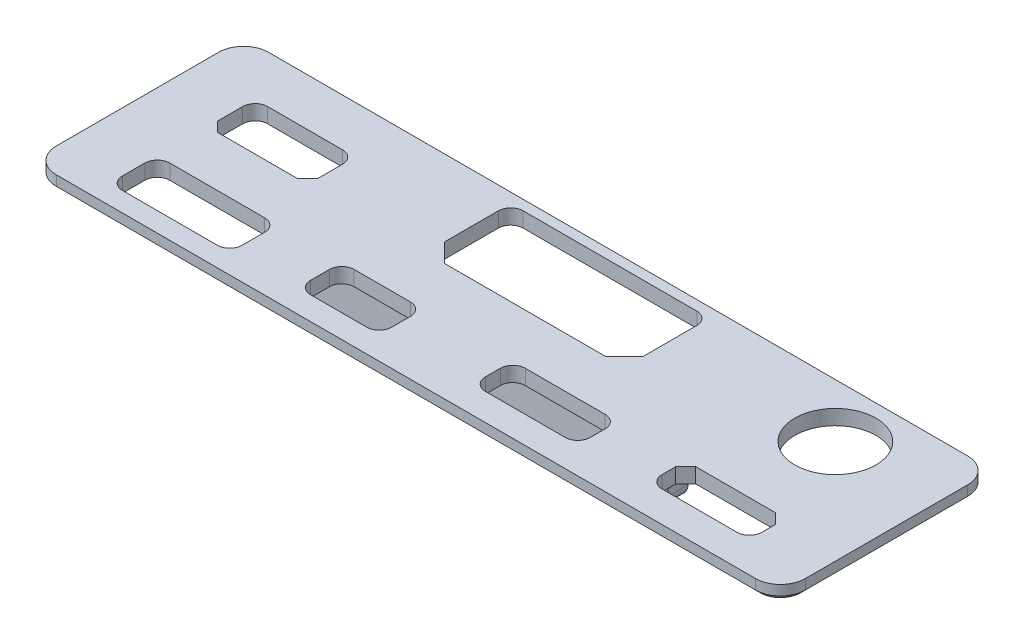
from build123d import *

# Parameters (mm, degrees)
SKETCH_1_W          = 60
SKETCH_1_H          = 17
EXTRUDE_1_DEPTH     = 1.2
CUT_EXTRUDE_1_REACH = 33.204
SKETCH_4_R          = 3.25
SKETCH_4_W          = 8
SKETCH_4_H          = 3.8
SKETCH_4_W_2        = 15.9
SKETCH_4_H_2        = 6.8
SKETCH_4_H_3        = 2.9
SKETCH_4_W_3        = 8.4
SKETCH_4_H_4        = 3.2
SKETCH_4_W_4        = 6.5
SKETCH_4_H_5        = 3.5
SKETCH_4_W_5        = 9.6
FILLET_2_R          = 1
CHAMFER_1_SIZE      = 0.8
SKETCH_5_W          = 1.5
SKETCH_5_H          = 8
EXTRUDE_2_DEPTH     = 1.2
SKETCH_6_W          = 28.5
SKETCH_6_H          = 1.6
EXTRUDE_3_DEPTH     = 4
FILLET_3_R          = 1
CHAMFER_2_SIZE      = 1
FILLET_4_R          = 2
CHAMFER_5_SIZE      = 0.4
CHAMFER_6_SIZE      = 1.5


with BuildPart() as part:
    # 草图1 → 凸台-拉伸1 (new body)
    with BuildSketch(Plane(origin=(0, 0, 0), x_dir=(1, 0, 0), z_dir=(0, 1, 0))):
        Rectangle(SKETCH_1_W, SKETCH_1_H)
    extrude(amount=EXTRUDE_1_DEPTH)

    # 草图4 → 切除-拉伸1 (cut, up to next)
    with BuildSketch(Plane(origin=(0, 1.2, 0), x_dir=(1, 0, 0), z_dir=(0, 1, 0)), mode=Mode.PRIVATE) as cut_extrude_1_sk1:
        with Locations(Location((21.7, 4.2, 0), (0, 0, 270))):
            Circle(SKETCH_4_R)
    cut_extrude_1_tool1 = extrude(cut_extrude_1_sk1.sketch, amount=-CUT_EXTRUDE_1_REACH, mode=Mode.PRIVATE) & part.part
    # 草图4 → 切除-拉伸1 (cut, up to next)
    with BuildSketch(Plane(origin=(0, 1.2, 0), x_dir=(1, 0, 0), z_dir=(0, 1, 0)), mode=Mode.PRIVATE) as cut_extrude_1_sk2:
        with Locations((-21.271722325, 2.8)):
            Rectangle(SKETCH_4_W, SKETCH_4_H)
    cut_extrude_1_tool2 = extrude(cut_extrude_1_sk2.sketch, amount=-CUT_EXTRUDE_1_REACH, mode=Mode.PRIVATE) & part.part
    # 草图4 → 切除-拉伸1 (cut, up to next)
    with BuildSketch(Plane(origin=(0, 1.2, 0), x_dir=(1, 0, 0), z_dir=(0, 1, 0)), mode=Mode.PRIVATE) as cut_extrude_1_sk3:
        with Locations((0.15, 4.3)):
            Rectangle(SKETCH_4_W_2, SKETCH_4_H_2)
    cut_extrude_1_tool3 = extrude(cut_extrude_1_sk3.sketch, amount=-CUT_EXTRUDE_1_REACH, mode=Mode.PRIVATE) & part.part
    # 草图4 → 切除-拉伸1 (cut, up to next)
    with BuildSketch(Plane(origin=(0, 1.2, 0), x_dir=(1, 0, 0), z_dir=(0, 1, 0)), mode=Mode.PRIVATE) as cut_extrude_1_sk4:
        with Locations((21.05, -4.584803861)):
            Rectangle(SKETCH_4_W, SKETCH_4_H_3)
    cut_extrude_1_tool4 = extrude(cut_extrude_1_sk4.sketch, amount=-CUT_EXTRUDE_1_REACH, mode=Mode.PRIVATE) & part.part
    # 草图4 → 切除-拉伸1 (cut, up to next)
    with BuildSketch(Plane(origin=(0, 1.2, 0), x_dir=(1, 0, 0), z_dir=(0, 1, 0)), mode=Mode.PRIVATE) as cut_extrude_1_sk5:
        with Locations((7.4, -4.734803861)):
            Rectangle(SKETCH_4_W_3, SKETCH_4_H_4)
    cut_extrude_1_tool5 = extrude(cut_extrude_1_sk5.sketch, amount=-CUT_EXTRUDE_1_REACH, mode=Mode.PRIVATE) & part.part
    # 草图4 → 切除-拉伸1 (cut, up to next)
    with BuildSketch(Plane(origin=(0, 1.2, 0), x_dir=(1, 0, 0), z_dir=(0, 1, 0)), mode=Mode.PRIVATE) as cut_extrude_1_sk6:
        with Locations((-7.25, -4.884803861)):
            Rectangle(SKETCH_4_W_4, SKETCH_4_H_5)
    cut_extrude_1_tool6 = extrude(cut_extrude_1_sk6.sketch, amount=-CUT_EXTRUDE_1_REACH, mode=Mode.PRIVATE) & part.part
    # 草图4 → 切除-拉伸1 (cut, up to next)
    with BuildSketch(Plane(origin=(0, 1.2, 0), x_dir=(1, 0, 0), z_dir=(0, 1, 0)), mode=Mode.PRIVATE) as cut_extrude_1_sk7:
        with Locations((-20.471722325, -5.034803861)):
            Rectangle(SKETCH_4_W_5, SKETCH_4_H)
    cut_extrude_1_tool7 = extrude(cut_extrude_1_sk7.sketch, amount=-CUT_EXTRUDE_1_REACH, mode=Mode.PRIVATE) & part.part
    add(cut_extrude_1_tool1.solids().sort_by_distance((21.7, 1.2, -4.2))[0], mode=Mode.SUBTRACT)
    add(cut_extrude_1_tool2.solids().sort_by_distance((-21.271722, 1.2, -2.8))[0], mode=Mode.SUBTRACT)
    add(cut_extrude_1_tool3.solids().sort_by_distance((0.15, 1.2, -4.3))[0], mode=Mode.SUBTRACT)
    add(cut_extrude_1_tool4.solids().sort_by_distance((21.05, 1.2, 4.584804))[0], mode=Mode.SUBTRACT)
    add(cut_extrude_1_tool5.solids().sort_by_distance((7.4, 1.2, 4.734804))[0], mode=Mode.SUBTRACT)
    add(cut_extrude_1_tool6.solids().sort_by_distance((-7.25, 1.2, 4.884804))[0], mode=Mode.SUBTRACT)
    add(cut_extrude_1_tool7.solids().sort_by_distance((-20.471722, 1.2, 5.034804))[0], mode=Mode.SUBTRACT)

    # 圆角2
    fillet_2_edges = [part.edges().sort_by_distance(p)[0] for p in [
        (-10.5, 0.6, 6.634803861),
        (-10.5, 0.6, 3.134803861),
        (-4, 0.6, 3.134803861),
        (-4, 0.6, 6.634803861),
        (3.2, 0.6, 6.334803861),
        (3.2, 0.6, 3.134803861),
        (11.6, 0.6, 3.134803861),
        (11.6, 0.6, 6.334803861),
        (17.05, 0.6, 6.034803861),
        (25.05, 0.6, 6.034803861),
        (-7.8, 0.6, -7.7),
        (8.1, 0.6, -7.7),
        (-25.271722325, 0.6, 6.934803861),
        (-25.271722325, 0.6, 3.134803861),
        (-15.671722325, 0.6, 3.134803861),
        (-15.671722325, 0.6, 6.934803861),
        (-25.271722325, 0.6, -4.7),
        (-17.271722325, 0.6, -4.7),
    ]]
    fillet(fillet_2_edges, radius=FILLET_2_R)

    # 倒角1
    chamfer_1_edges = [part.edges().sort_by_distance(p)[0] for p in [
        (17.05, 0.6, 3.134803861),
        (25.05, 0.6, 3.134803861),
        (-25.271722325, 0.6, -0.9),
        (-17.271722325, 0.6, -0.9),
    ]]
    chamfer(chamfer_1_edges, length=CHAMFER_1_SIZE)

    # 草图5 → 凸台-拉伸2 (add)
    with BuildSketch(Plane.XZ):
        with Locations((-13.15891381, 0.61681071)):
            Rectangle(SKETCH_5_W, SKETCH_5_H)
        with Locations((13.84108619, 0.61681071)):
            Rectangle(SKETCH_5_W, SKETCH_5_H)
    extrude(amount=EXTRUDE_2_DEPTH)

    # 草图6 → 凸台-拉伸3 (add)
    with BuildSketch(Plane.XZ):
        with Locations((0.34108619, 1.3)):
            Rectangle(SKETCH_6_W, SKETCH_6_H)
    extrude(amount=EXTRUDE_3_DEPTH)

    # 圆角3
    fillet_3_edges = [part.edges().sort_by_distance(p)[0] for p in [
        (-13.90891381, -4, 1.3),
        (14.59108619, -4, 1.3),
    ]]
    fillet(fillet_3_edges, radius=FILLET_3_R)

    # 倒角2
    chamfer_2_edges = [part.edges().sort_by_distance(p)[0] for p in [
        (-13.15891381, -1.2, -3.38318929),
        (-13.15891381, -1.2, 4.61681071),
        (13.84108619, -1.2, -3.38318929),
        (13.84108619, -1.2, 4.61681071),
    ]]
    chamfer(chamfer_2_edges, length=CHAMFER_2_SIZE)

    # 圆角4
    fillet_4_edges = [part.edges().sort_by_distance(p)[0] for p in [
        (30, 0.6, 8.5),
        (-30, 0.6, 8.5),
        (-30, 0.6, -8.5),
        (30, 0.6, -8.5),
    ]]
    fillet(fillet_4_edges, radius=FILLET_4_R)

    # 倒角5
    chamfer_5_edges = [part.edges().sort_by_distance(p)[0] for p in [
        (30, 0, 0),
        (0, 0, 8.5),
        (-30, 0, 0),
        (0, 0, -8.5),
        (-29.414213562, 0, -7.914213562),
        (-29.414213562, 0, 7.914213562),
        (29.414213562, 0, -7.914213562),
        (29.414213562, 0, 7.914213562),
    ]]
    chamfer(chamfer_5_edges, length=CHAMFER_5_SIZE)

    # 倒角6
    chamfer_6_edges = [part.edges().sort_by_distance(p)[0] for p in [
        (-7.8, 0.6, -0.9),
        (8.1, 0.6, -0.9),
    ]]
    chamfer(chamfer_6_edges, length=CHAMFER_6_SIZE)


solid = part.part
